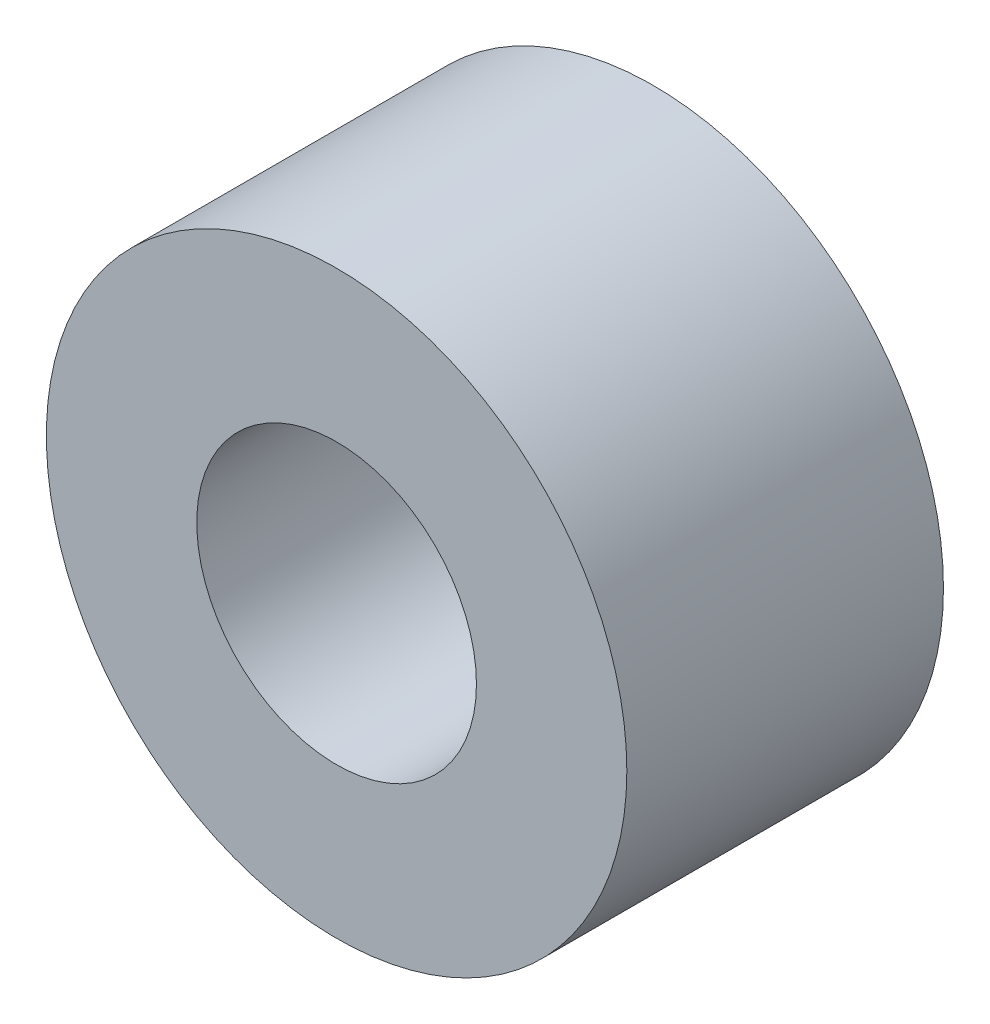
from build123d import *

# Parameters (mm, degrees)
CROQUIS1_R              = 5.5
CROQUIS1_R_2            = 2.65
SALIENTE_EXTRUIR1_DEPTH = 6


with BuildPart() as part:
    # Croquis1 → Saliente-Extruir1 (new body)
    with BuildSketch(Plane.XY):
        Circle(CROQUIS1_R)
        Circle(CROQUIS1_R_2, mode=Mode.SUBTRACT)
    extrude(amount=SALIENTE_EXTRUIR1_DEPTH)


solid = part.part
